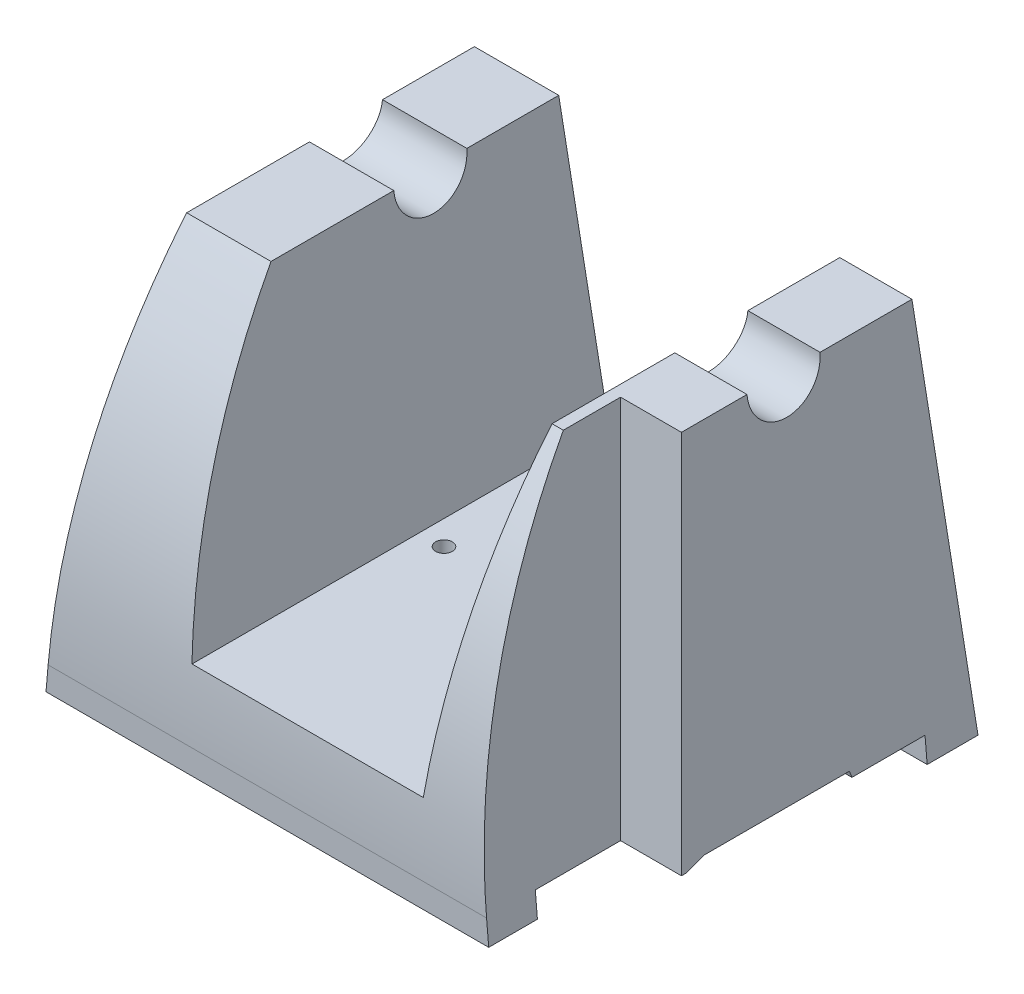
from build123d import *

# Parameters (mm, degrees)
BOSS_EXTRUDE1_DEPTH     = 130.175
CUT_EXTRUDE1_DEPTH      = 198.438033
CUT_EXTRUDE1_DEPTH_BACK = 198.438033
SKETCH2_W               = 57.15
SKETCH2_H               = 74.103907915
SKETCH3_W               = 15.875
SKETCH3_H               = 34.925
CUT_EXTRUDE2_DEPTH      = 198.438033
DRAFT1_ANGLE            = -5
CUT_EXTRUDE3_DEPTH      = 188.228236601
CUT_EXTRUDE3_DEPTH_BACK = 188.228236601
SKETCH4_R               = 2.178428953


with BuildPart() as part:
    # Sketch1 → Boss-Extrude1 (new body)
    with BuildSketch(Plane(origin=(0, 0, 0), x_dir=(0, 0, -1), z_dir=(1, 0, 0))):
        with BuildLine():
            Line((0, 0), (0, 6.35))
            ThreePointArc((0, 6.35), (7.170490025, 54.477745417), (28.059114221, 98.425))
            Line((28.059114221, 98.425), (60.067057111, 98.425))
            ThreePointArc((60.067057111, 98.425), (69.592057111, 88.9), (79.117057111, 98.425))
            Line((79.117057111, 98.425), (111.125, 98.425))
            Line((111.125, 98.425), (111.125, 0))
            Line((111.125, 0), (98.425, 0))
            Line((98.425, 0), (98.425, 6.35))
            Line((98.425, 6.35), (79.375, 6.35))
            Line((79.375, 6.35), (78.839467499, 7.9375))
            Line((78.839467499, 7.9375), (40.880795395, 7.9375))
            Line((40.880795395, 7.9375), (36.174906872, 6.35))
            Line((36.174906872, 6.35), (12.7, 6.35))
            Line((12.7, 6.35), (12.7, 0))
            Line((12.7, 0), (0, 0))
        make_face()
    extrude(amount=BOSS_EXTRUDE1_DEPTH)

    # Sketch2 → Cut-Extrude1 (cut, two sides: drawn at the far end of the back side and taken through both)
    with BuildSketch(Plane(origin=(0, 0, -111.125), x_dir=(-1, 0, 0), z_dir=(0, 0, -1)).offset(-CUT_EXTRUDE1_DEPTH_BACK)):
        with Locations((-66.675, 61.373046043)):
            Rectangle(SKETCH2_W, SKETCH2_H)
    extrude(amount=CUT_EXTRUDE1_DEPTH + CUT_EXTRUDE1_DEPTH_BACK, mode=Mode.SUBTRACT)

    # Sketch3 → Cut-Extrude2 (cut, through all)
    with BuildSketch(Plane(origin=(0, 98.425, 0), x_dir=(1, 0, 0), z_dir=(0, 1, 0))):
        with Locations((122.2375, 17.4625)):
            Rectangle(SKETCH3_W, SKETCH3_H)
    extrude(amount=-CUT_EXTRUDE2_DEPTH, mode=Mode.SUBTRACT)

    # Draft1
    draft1_faces = [part.faces().sort_by_distance(p)[0] for p in [
        (1.631962354, 49.2125, -111.125),
        (122.2375, 52.3875, -34.925),
        (130.175, 51.366021229, -73.60068913),
        (114.3, 42.899391588, -20.187689821),
        (95.25, 59.043863813, -60.63952827),
        (0, 49.133887707, -59.518940982),
        (38.1, 59.043863813, -60.63952827),
    ]]
    draft(draft1_faces, Plane(origin=(130.175, 6.35, -36.174906872), x_dir=(0, 0, -1), z_dir=(0, -1, 0)), DRAFT1_ANGLE)

    # Sketch4 → Cut-Extrude3 (cut, two sides: drawn at the far end of the back side and taken through both)
    with BuildSketch(Plane(origin=(0, 24.321092085, 0), x_dir=(1, 0, 0), z_dir=(0, 1, 0)).offset(-CUT_EXTRUDE3_DEPTH_BACK)):
        with Locations(Location((42.869708487, 60.325, 0), (0, 0, 270))):
            Circle(SKETCH4_R)
    extrude(amount=CUT_EXTRUDE3_DEPTH + CUT_EXTRUDE3_DEPTH_BACK, mode=Mode.SUBTRACT)


solid = part.part
